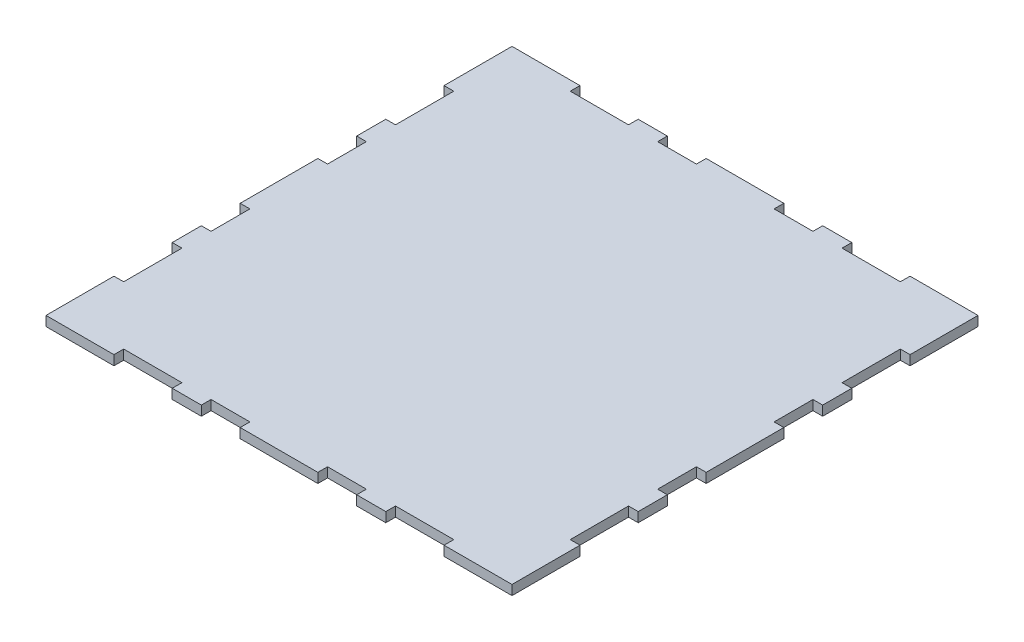
from build123d import *

# Parameters (mm, degrees)
BOSS_EXTRUDE1_DEPTH = 6.35


with BuildPart() as part:
    # Sketch2 → Boss-Extrude1 (new body)
    with BuildSketch(Plane(origin=(0, 0, 0), x_dir=(1, 0, 0), z_dir=(0, 1, 0))):
        Polygon((0, 0), (152.4, 152.4), (0, 152.4), (0, 127), (6.35, 127), (6.35, 101.6), (0, 101.6), (0, 82.55), (6.35, 82.55), (6.35, 44.45), (0, 44.45), align=None)
        Polygon((127, 0), (152.4, 0), (152.4, 152.4), (0, 0), (44.45, 0), (44.45, 6.35), (82.55, 6.35), (82.55, 0), (101.6, 0), (101.6, 6.35), (127, 6.35), align=None)
        Polygon((152.4, 152.4), (152.4, 0), (177.8, 0), (177.8, 6.35), (203.2, 6.35), (203.2, 0), (222.25, 0), (222.25, 6.35), (260.35, 6.35), (260.35, 0), (304.8, 0), (304.8, 44.45), (298.45, 44.45), (298.45, 82.55), (304.8, 82.55), (304.8, 101.6), (298.45, 101.6), (298.45, 127), (304.8, 127), (304.8, 152.4), align=None)
        Polygon((304.8, 304.8), (152.4, 152.4), (304.8, 152.4), (304.8, 177.8), (298.45, 177.8), (298.45, 203.2), (304.8, 203.2), (304.8, 222.25), (298.45, 222.25), (298.45, 260.35), (304.8, 260.35), align=None)
        Polygon((152.4, 304.8), (152.4, 152.4), (304.8, 304.8), (260.35, 304.8), (260.35, 298.45), (222.25, 298.45), (222.25, 304.8), (203.2, 304.8), (203.2, 298.45), (177.8, 298.45), (177.8, 304.8), align=None)
        Polygon((0, 152.4), (152.4, 152.4), (152.4, 304.8), (127, 304.8), (127, 298.45), (101.6, 298.45), (101.6, 304.8), (82.55, 304.8), (82.55, 298.45), (44.45, 298.45), (44.45, 304.8), (0, 304.8), (0, 260.35), (6.35, 260.35), (6.35, 222.25), (0, 222.25), (0, 203.2), (6.35, 203.2), (6.35, 177.8), (0, 177.8), align=None)
    extrude(amount=BOSS_EXTRUDE1_DEPTH)


solid = part.part
